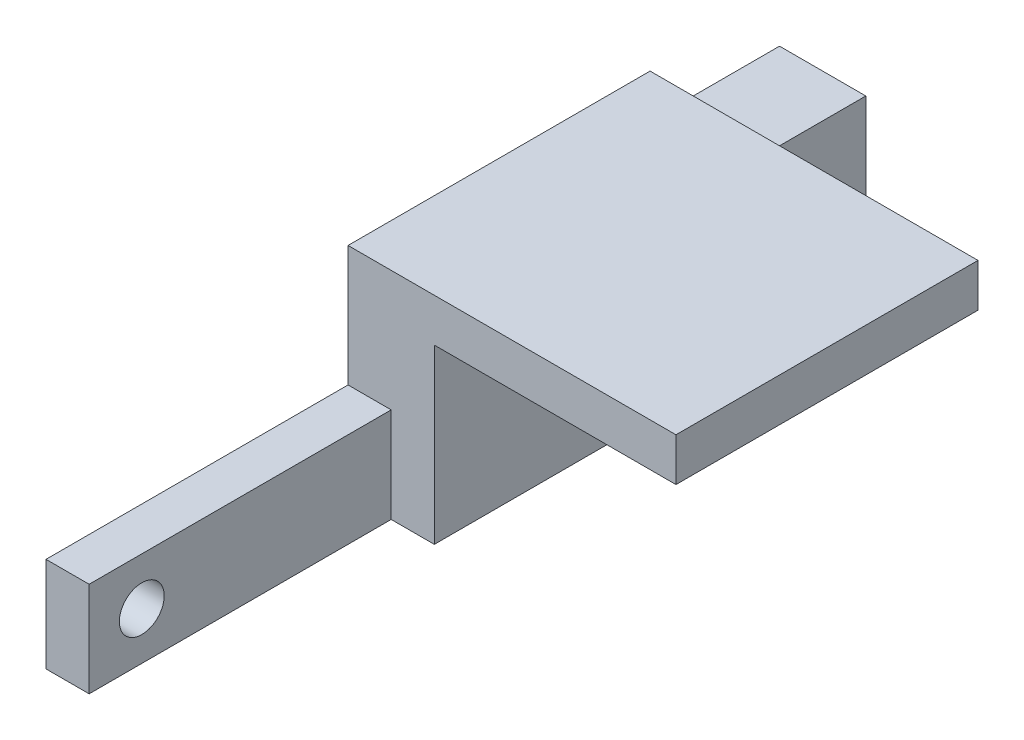
from build123d import *

# Parameters (mm, degrees)
SKETCH_1_W          = 38
SKETCH_1_H          = 35
EXTRUDE_1_DEPTH     = 5
SKETCH_1_14_W       = 10
SKETCH_1_14_H       = 50
EXTRUDE_2_DEPTH     = 20
EXTRUDE_START       = -5
SKETCH_2_W          = 35
SKETCH_2_H          = 11
SKETCH_2_R          = 2.6
EXTRUDE_3_DEPTH     = 5
CUT_EXTRUDE_START   = -10
SKETCH_2_3_R        = 0.6
SKETCH_2_3_R_2      = 1.5
CUT_EXTRUDE_1_DEPTH = 3


with BuildPart() as part:
    # 草图1 → 凸台-拉伸1 (new body)
    with BuildSketch(Plane(origin=(0, 0, 0), x_dir=(1, 0, 0), z_dir=(0, 1, 0))):
        with Locations((19, -17.5)):
            Rectangle(SKETCH_1_W, SKETCH_1_H)
    extrude(amount=EXTRUDE_1_DEPTH)

    # 草图1<14> → 凸台-拉伸2 (add)
    with BuildSketch(Plane(origin=(0, 0, 0), x_dir=(1, 0, 0), z_dir=(0, 1, 0))):
        with Locations((5, -10)):
            Rectangle(SKETCH_1_14_W, SKETCH_1_14_H)
    extrude(amount=-EXTRUDE_2_DEPTH)

    # 草图2 → 凸台-拉伸3 (add)
    with BuildSketch(Plane(origin=(10, 0, 0), x_dir=(0, 0, -1), z_dir=(1, 0, 0)).offset(EXTRUDE_START)):
        with Locations((-52.5, -14.5)):
            Rectangle(SKETCH_2_W, SKETCH_2_H)
        with Locations((-63.9, -14.5)):
            Circle(SKETCH_2_R, mode=Mode.SUBTRACT)
    extrude(amount=-EXTRUDE_3_DEPTH)

    # 草图2<3> → 切除-拉伸1 (cut)
    with BuildSketch(Plane(origin=(10, 0, 0), x_dir=(0, 0, -1), z_dir=(1, 0, 0)).offset(CUT_EXTRUDE_START)):
        with Locations((-56.3, -14.5)):
            Circle(SKETCH_2_3_R)
        with Locations((-51.4, -14.5)):
            Circle(SKETCH_2_3_R_2)
    extrude(amount=CUT_EXTRUDE_1_DEPTH, mode=Mode.SUBTRACT)


solid = part.part
